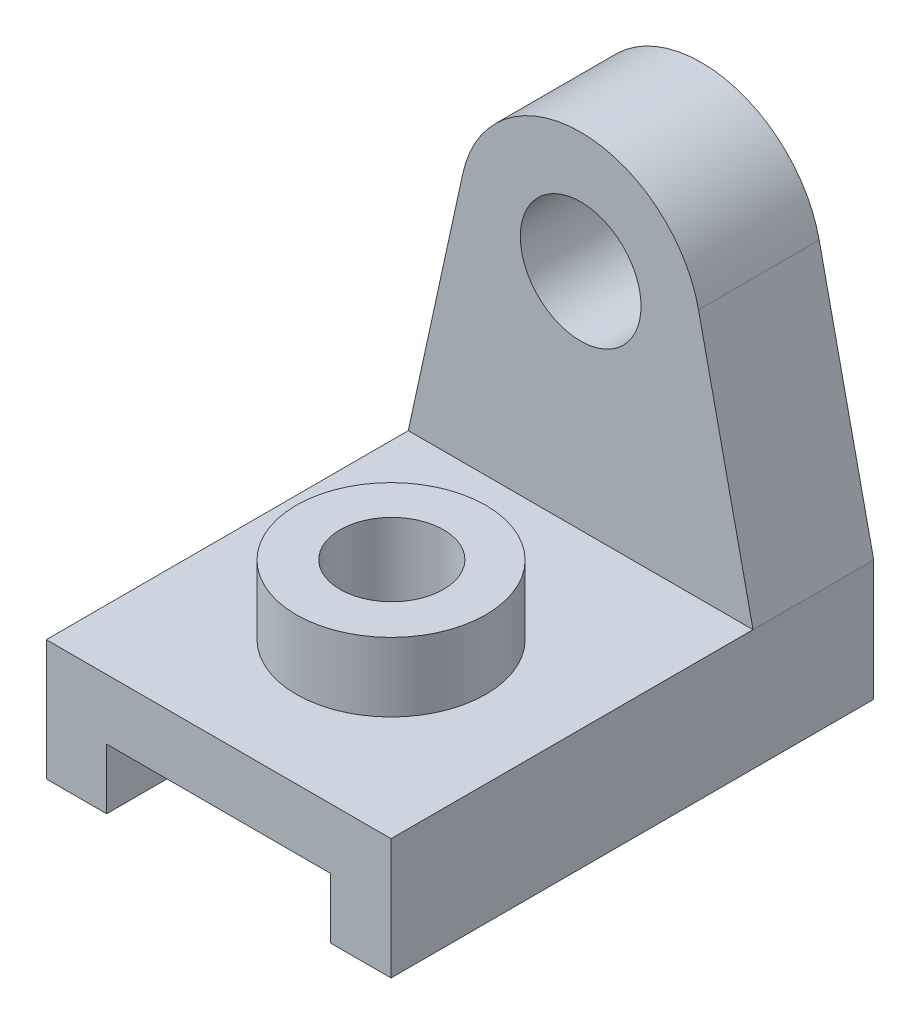
from build123d import *

# Parameters (mm, degrees)
EXTRUDE_1_DEPTH     = 56
SKETCH_2_R          = 7
EXTRUDE_2_DEPTH     = 14
SKETCH_3_R          = 11
EXTRUDE_3_DEPTH     = 8
SKETCH_5_R          = 6
CUT_EXTRUDE_2_DEPTH = 28


with BuildPart() as part:
    # 草图1 → 凸台-拉伸1 (new body)
    with BuildSketch(Plane.XY):
        Polygon((-13, -7), (-13, 0), (13, 0), (13, -7), (20, -7), (20, 7), (-20, 7), (-20, -7), align=None)
    extrude(amount=EXTRUDE_1_DEPTH)

    # 草图2 → 凸台-拉伸2 (add)
    with BuildSketch(Plane(origin=(0, 0, 0), x_dir=(-1, 0, 0), z_dir=(0, 0, -1))):
        with BuildLine():
            Line((-20, 7), (20, 7))
            Line((20, 7), (13.678424719, 35.98340363))
            ThreePointArc((13.678424719, 35.98340363), (0, 47), (-13.678424719, 35.98340363))
            Line((-13.678424719, 35.98340363), (-20, 7))
        make_face()
        with Locations((0, 33)):
            Circle(SKETCH_2_R, mode=Mode.SUBTRACT)
    extrude(amount=-EXTRUDE_2_DEPTH)

    # 草图3 → 凸台-拉伸3 (add)
    with BuildSketch(Plane(origin=(0, 7, 0), x_dir=(1, 0, 0), z_dir=(0, 1, 0))):
        with Locations((0, -36)):
            Circle(SKETCH_3_R)
    extrude(amount=EXTRUDE_3_DEPTH)

    # 草图5 → 切除-拉伸2 (cut)
    with BuildSketch(Plane(origin=(0, 15, 0), x_dir=(1, 0, 0), z_dir=(0, 1, 0))):
        with Locations((0, -35.911740673)):
            Circle(SKETCH_5_R)
    extrude(amount=-CUT_EXTRUDE_2_DEPTH, mode=Mode.SUBTRACT)


solid = part.part
